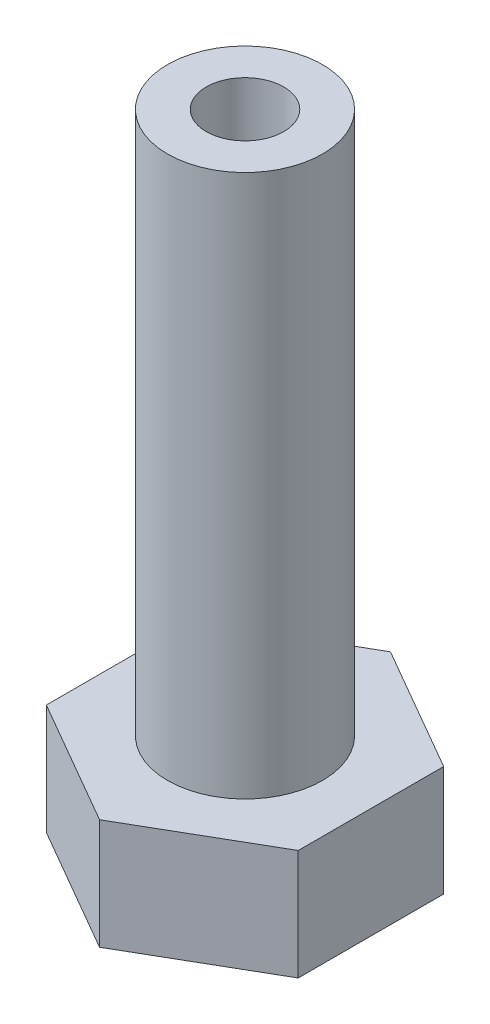
from build123d import *

# Parameters (mm, degrees)
BOSS_EXTRUDE1_DEPTH = 5.7
SKETCH2_R           = 4
BOSS_EXTRUDE2_DEPTH = 28
SKETCH3_R           = 2
CUT_EXTRUDE1_DEPTH  = 8


with BuildPart() as part:
    # Sketch1 → Boss-Extrude1 (new body)
    with BuildSketch(Plane(origin=(0, 0, 0), x_dir=(1, 0, 0), z_dir=(0, 1, 0))):
        Polygon((0, -7.505553499), (6.5, -3.75277675), (6.5, 3.75277675), (0, 7.505553499), (-6.5, 3.75277675), (-6.5, -3.75277675), align=None)
    extrude(amount=BOSS_EXTRUDE1_DEPTH)

    # Sketch2 → Boss-Extrude2 (add)
    with BuildSketch(Plane(origin=(0, 5.7, 0), x_dir=(1, 0, 0), z_dir=(0, 1, 0))):
        with Locations(Location((0, 0, 0), (0, 0, 270))):
            Circle(SKETCH2_R)
    extrude(amount=BOSS_EXTRUDE2_DEPTH)

    # Sketch3 → Cut-Extrude1 (cut)
    with BuildSketch(Plane(origin=(0, 33.7, 0), x_dir=(1, 0, 0), z_dir=(0, 1, 0))):
        with Locations(Location((0, 0, 0), (0, 0, 270))):
            Circle(SKETCH3_R)
    extrude(amount=-CUT_EXTRUDE1_DEPTH, mode=Mode.SUBTRACT)


solid = part.part
